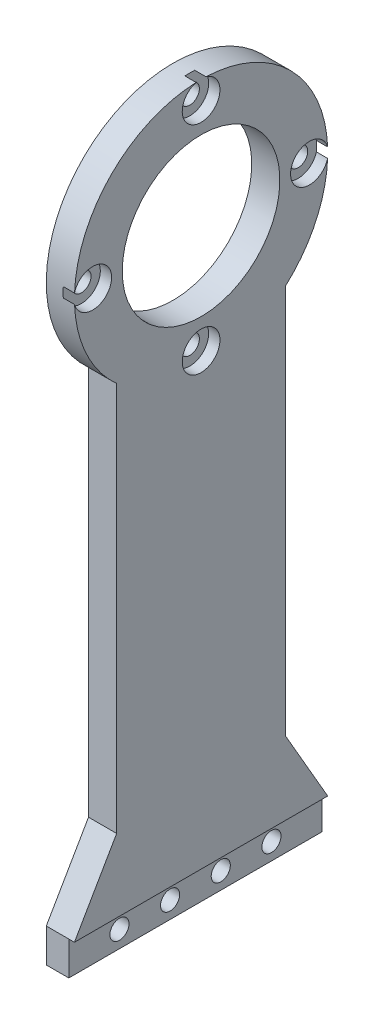
from build123d import *

# Parameters (mm, degrees)
SKETCH_1_W                  = 5
SKETCH_1_H                  = 30
EXTRUDE_1_DEPTH             = 227
SKETCH_2_R                  = 22.5
EXTRUDE_2_DEPTH             = 5
SKETCH_3_R                  = 14
CUT_EXTRUDE_1_DEPTH         = 231.130940988
HOLE_WIZARD_M31_D           = 3.4
HOLE_WIZARD_M31_CBORE_D     = 6.7
HOLE_WIZARD_M31_CBORE_DEPTH = 2
EXTRUDE_3_DEPTH             = 5
HOLE_WIZARD_M31_2_D         = 3.4
SKETCH_14_W                 = 45
SKETCH_14_H                 = 6
CUT_EXTRUDE_2_DEPTH         = 1
CUT_EXTRUDE_START           = -5
CUT_EXTRUDE_3_DEPTH         = 5


with BuildPart() as part:
    # Эскиз1 → Бобышка-Вытянуть1 (new body)
    with BuildSketch(Plane(origin=(0, 0, 0), x_dir=(1, 0, 0), z_dir=(0, 1, 0))):
        with Locations((2.5, -15)):
            Rectangle(SKETCH_1_W, SKETCH_1_H)
    extrude(amount=EXTRUDE_1_DEPTH)

    # Эскиз2 → Бобышка-Вытянуть2 (add)
    with BuildSketch(Plane.ZY):
        with Locations((15, 105)):
            Circle(SKETCH_2_R)
    extrude(amount=-EXTRUDE_2_DEPTH)

    # Эскиз3 → Вырез-Вытянуть1 (cut, through all)
    with BuildSketch(Plane.ZY):
        with Locations((15, 105)):
            Circle(SKETCH_3_R)
    extrude(amount=-CUT_EXTRUDE_1_DEPTH, mode=Mode.SUBTRACT)

    # Hole Wizard M31 (through all)
    with Locations(Plane(origin=(5, -25.024735225, 7.262908886), x_dir=(0, 0, 1), z_dir=(1, 0, 0))):
        with Locations((7.737091114, -149.274735225), (-11.512908886, -130.024735225), (7.737091114, -110.774735225), (26.987091114, -130.024735225)):
            CounterBoreHole(HOLE_WIZARD_M31_D / 2, HOLE_WIZARD_M31_CBORE_D / 2, HOLE_WIZARD_M31_CBORE_DEPTH)

    # Эскиз11 → Бобышка-Вытянуть3 (add)
    with BuildSketch(Plane(origin=(5, 0, 0), x_dir=(0, 0, -1), z_dir=(1, 0, 0))):
        Polygon((0, 18.990381057), (7.5, 6), (7.5, 0), (-37.5, 0), (-37.5, 6), (-30, 18.990381057), align=None)
    extrude(amount=-EXTRUDE_3_DEPTH)

    # Hole Wizard M31 2 (through all)
    with Locations(Plane(origin=(5, 0, 0), x_dir=(0, 0, -1), z_dir=(1, 0, 0))):
        with Locations((-28.5, 3), (-19.5, 3), (-10.5, 3), (-1.5, 3)):
            Hole(HOLE_WIZARD_M31_2_D / 2)

    # Эскиз14 → Вырез-Вытянуть2 (cut)
    with BuildSketch(Plane(origin=(5, 0, 0), x_dir=(0, 0, -1), z_dir=(1, 0, 0))):
        with Locations((-15, 3)):
            Rectangle(SKETCH_14_W, SKETCH_14_H)
    extrude(amount=-CUT_EXTRUDE_2_DEPTH, mode=Mode.SUBTRACT)

    # Эскиз15 → Вырез-Вытянуть3 (cut)
    with BuildSketch(Plane(origin=(5, 0, 0), x_dir=(0, 0, -1), z_dir=(1, 0, 0)).offset(CUT_EXTRUDE_START)):
        with BuildLine():
            Line((-30, 227), (0, 227))
            Line((0, 227), (0, 121.770509831))
            ThreePointArc((0, 121.770509831), (-15, 127.5), (-30, 121.770509831))
            Line((-30, 121.770509831), (-30, 227))
        make_face()
    extrude(amount=CUT_EXTRUDE_3_DEPTH, mode=Mode.SUBTRACT)


solid = part.part
